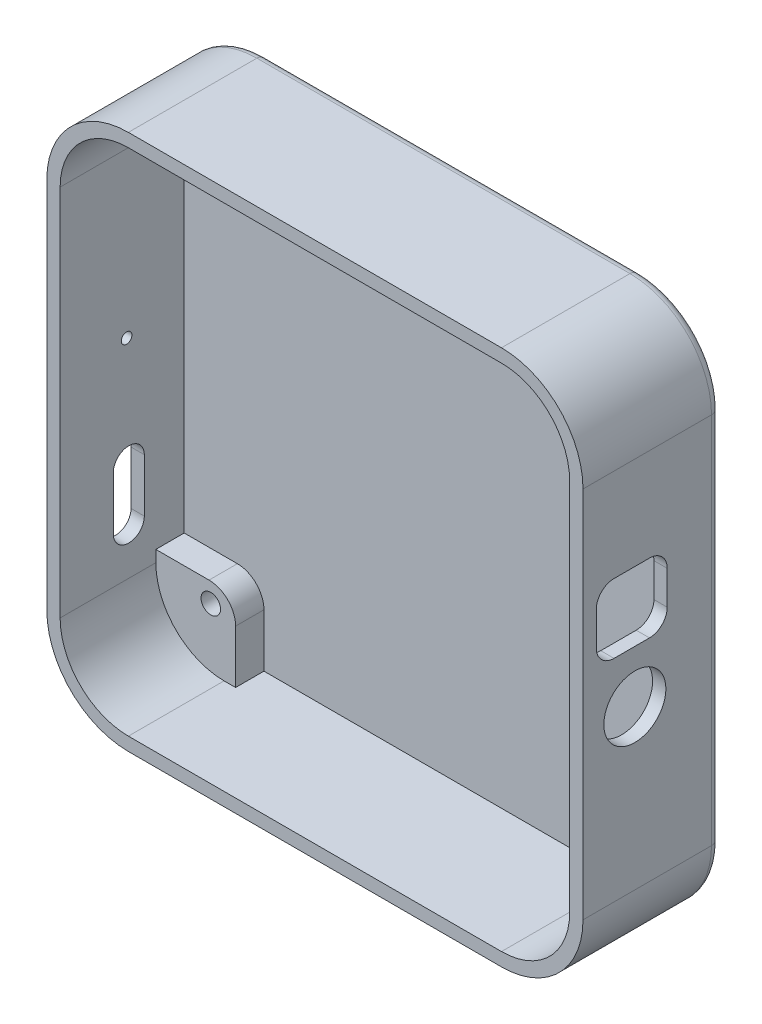
from build123d import *

# Parameters (mm, degrees)
EXTRUDE_1_DEPTH     = 1.5
EXTRUDE_3_DEPTH     = 14
SKETCH_4_R          = 1.1
EXTRUDE_4_DEPTH     = 3.2
SKETCH_5_R          = 1.1
EXTRUDE_5_DEPTH     = 3.2
SKETCH_8_R          = 1.1
EXTRUDE_7_DEPTH     = 3.2
SKETCH_9_R          = 0.6
CUT_EXTRUDE_5_DEPTH = 1.5
CUT_EXTRUDE_6_DEPTH = 1.5
CUT_EXTRUDE_7_REACH = 88.953
SKETCH_16_R         = 3.5
FILLET_1_R          = 1


with BuildPart() as part:
    # 草图1 → 凸台-拉伸1 (new body)
    with BuildSketch(Plane.XY):
        with BuildLine():
            Line((-3.146845785, 60.5), (38.953154215, 60.5))
            ThreePointArc((38.953154215, 60.5), (45.458536602, 57.805382387), (48.153154215, 51.3))
            Line((48.153154215, 51.3), (48.153154215, 9.2))
            ThreePointArc((48.153154215, 9.2), (45.458536602, 2.694617613), (38.953154215, 0))
            Line((38.953154215, 0), (-3.146845785, 0))
            ThreePointArc((-3.146845785, 0), (-9.652228172, 2.694617613), (-12.346845785, 9.2))
            Line((-12.346845785, 9.2), (-12.346845785, 51.3))
            ThreePointArc((-12.346845785, 51.3), (-9.652228172, 57.805382387), (-3.146845785, 60.5))
        make_face()
    extrude(amount=EXTRUDE_1_DEPTH)

    # 草图3 → 凸台-拉伸3 (add)
    with BuildSketch(Plane.XY.offset(1.5)):
        with BuildLine():
            Line((38.953154215, 60.5), (-3.146845785, 60.5))
            ThreePointArc((-3.146845785, 60.5), (-9.652228172, 57.805382387), (-12.346845785, 51.3))
            Line((-12.346845785, 51.3), (-12.346845785, 9.2))
            ThreePointArc((-12.346845785, 9.2), (-9.652228172, 2.694617613), (-3.146845785, 0))
            Line((-3.146845785, 0), (38.953154215, 0))
            ThreePointArc((38.953154215, 0), (45.458536602, 2.694617613), (48.153154215, 9.2))
            Line((48.153154215, 9.2), (48.153154215, 51.3))
            ThreePointArc((48.153154215, 51.3), (45.458536602, 57.805382387), (38.953154215, 60.5))
        make_face()
        with BuildLine():
            Line((38.953154215, 59), (-3.146845785, 59))
            ThreePointArc((-3.146845785, 59), (-8.591568001, 56.744722215), (-10.846845785, 51.3))
            Line((-10.846845785, 51.3), (-10.846845785, 9.2))
            ThreePointArc((-10.846845785, 9.2), (-8.591568001, 3.755277785), (-3.146845785, 1.5))
            Line((-3.146845785, 1.5), (38.953154215, 1.5))
            ThreePointArc((38.953154215, 1.5), (44.39787643, 3.755277785), (46.653154215, 9.2))
            Line((46.653154215, 9.2), (46.653154215, 51.3))
            ThreePointArc((46.653154215, 51.3), (44.39787643, 56.744722215), (38.953154215, 59))
        make_face(mode=Mode.SUBTRACT)
    extrude(amount=EXTRUDE_3_DEPTH)

    # 草图4 → 凸台-拉伸4 (add)
    with BuildSketch(Plane.XY.offset(1.5)):
        with BuildLine():
            Line((0, 52), (0, 59))
            Line((0, 59), (-3.146845785, 59))
            ThreePointArc((-3.146845785, 59), (-8.591568001, 56.744722215), (-10.846845785, 51.3))
            Line((-10.846845785, 51.3), (-10.846845785, 49))
            Line((-10.846845785, 49), (-3, 49))
            ThreePointArc((-3, 49), (-0.878679656, 49.878679656), (0, 52))
        make_face()
        with Locations((-4.646845785, 52.8)):
            Circle(SKETCH_4_R, mode=Mode.SUBTRACT)
    extrude(amount=EXTRUDE_4_DEPTH)

    # 草图5 → 凸台-拉伸5 (add)
    with BuildSketch(Plane.XY.offset(1.5)):
        with BuildLine():
            Line((-4.846845785, 10.5), (-10.846845785, 10.5))
            Line((-10.846845785, 10.5), (-10.846845785, 9.2))
            ThreePointArc((-10.846845785, 9.2), (-8.591568001, 3.755277785), (-3.146845785, 1.5))
            Line((-3.146845785, 1.5), (-1.846845785, 1.5))
            Line((-1.846845785, 1.5), (-1.846845785, 7.5))
            ThreePointArc((-1.846845785, 7.5), (-2.725525442, 9.621320344), (-4.846845785, 10.5))
        make_face()
        with Locations((-4.646845785, 8.3)):
            Circle(SKETCH_5_R, mode=Mode.SUBTRACT)
    extrude(amount=EXTRUDE_5_DEPTH)

    # 草图8 → 凸台-拉伸7 (add)
    with BuildSketch(Plane.XY.offset(1.5)):
        with BuildLine():
            Line((37.653154215, 7.5), (37.653154215, 1.5))
            Line((37.653154215, 1.5), (38.953154215, 1.5))
            ThreePointArc((38.953154215, 1.5), (44.39787643, 3.755277785), (46.653154215, 9.2))
            Line((46.653154215, 9.2), (46.653154215, 10.5))
            Line((46.653154215, 10.5), (40.653154215, 10.5))
            ThreePointArc((40.653154215, 10.5), (38.531833871, 9.621320344), (37.653154215, 7.5))
        make_face()
        with Locations((40.453154215, 8.3)):
            Circle(SKETCH_8_R, mode=Mode.SUBTRACT)
    extrude(amount=EXTRUDE_7_DEPTH)

    # 草图9 → 切除-拉伸5 (cut)
    with BuildSketch(Plane.ZY.offset(12.346845785)):
        with Locations(Location((8, 32.8, 0), (0, 0, 270))):
            Circle(SKETCH_9_R)
    extrude(amount=-CUT_EXTRUDE_5_DEPTH, mode=Mode.SUBTRACT)

    # 草图10 → 切除-拉伸6 (cut)
    with BuildSketch(Plane.ZY.offset(12.346845785)):
        with BuildLine():
            Line((9.5, 20.4), (9.5, 14.4))
            ThreePointArc((9.5, 14.4), (7.75, 12.65), (6, 14.4))
            Line((6, 14.4), (6, 20.4))
            ThreePointArc((6, 20.4), (7.75, 22.15), (9.5, 20.4))
        make_face()
    extrude(amount=-CUT_EXTRUDE_6_DEPTH, mode=Mode.SUBTRACT)

    # 草图16 → 切除-拉伸7 (cut, up to next)
    with BuildSketch(Plane(origin=(48.153154215, 0, 0), x_dir=(0, 0, -1), z_dir=(1, 0, 0)), mode=Mode.PRIVATE) as cut_extrude_7_sk1:
        with Locations((-9.65, 27.1)):
            Circle(SKETCH_16_R)
    cut_extrude_7_tool1 = extrude(cut_extrude_7_sk1.sketch, amount=-CUT_EXTRUDE_7_REACH, mode=Mode.PRIVATE) & part.part
    # 草图16 → 切除-拉伸7 (cut, up to next)
    with BuildSketch(Plane(origin=(48.153154215, 0, 0), x_dir=(0, 0, -1), z_dir=(1, 0, 0)), mode=Mode.PRIVATE) as cut_extrude_7_sk2:
        with BuildLine():
            Line((-12, 40.8), (-8, 40.8))
            ThreePointArc((-8, 40.8), (-6.585786438, 40.214213562), (-6, 38.8))
            Line((-6, 38.8), (-6, 35))
            ThreePointArc((-6, 35), (-6.585786438, 33.585786438), (-8, 33))
            Line((-8, 33), (-12, 33))
            ThreePointArc((-12, 33), (-13.414213562, 33.585786438), (-14, 35))
            Line((-14, 35), (-14, 38.8))
            ThreePointArc((-14, 38.8), (-13.414213562, 40.214213562), (-12, 40.8))
        make_face()
    cut_extrude_7_tool2 = extrude(cut_extrude_7_sk2.sketch, amount=-CUT_EXTRUDE_7_REACH, mode=Mode.PRIVATE) & part.part
    add(cut_extrude_7_tool1.solids().sort_by_distance((48.153154, 27.1, 9.65))[0], mode=Mode.SUBTRACT)
    add(cut_extrude_7_tool2.solids().sort_by_distance((48.153154, 36.9, 10))[0], mode=Mode.SUBTRACT)

    # 圆角1
    fillet_1_edges = [part.edges().sort_by_distance(p)[0] for p in [
        (-12.346845785, 30.25, 0),
        (-9.652228172, 57.805382387, 0),
        (17.903154215, 60.5, 0),
        (45.458536602, 57.805382387, 0),
        (48.153154215, 30.25, 0),
        (45.458536602, 2.694617613, 0),
        (17.903154215, 0, 0),
        (-9.652228172, 2.694617613, 0),
    ]]
    fillet(fillet_1_edges, radius=FILLET_1_R)


solid = part.part
